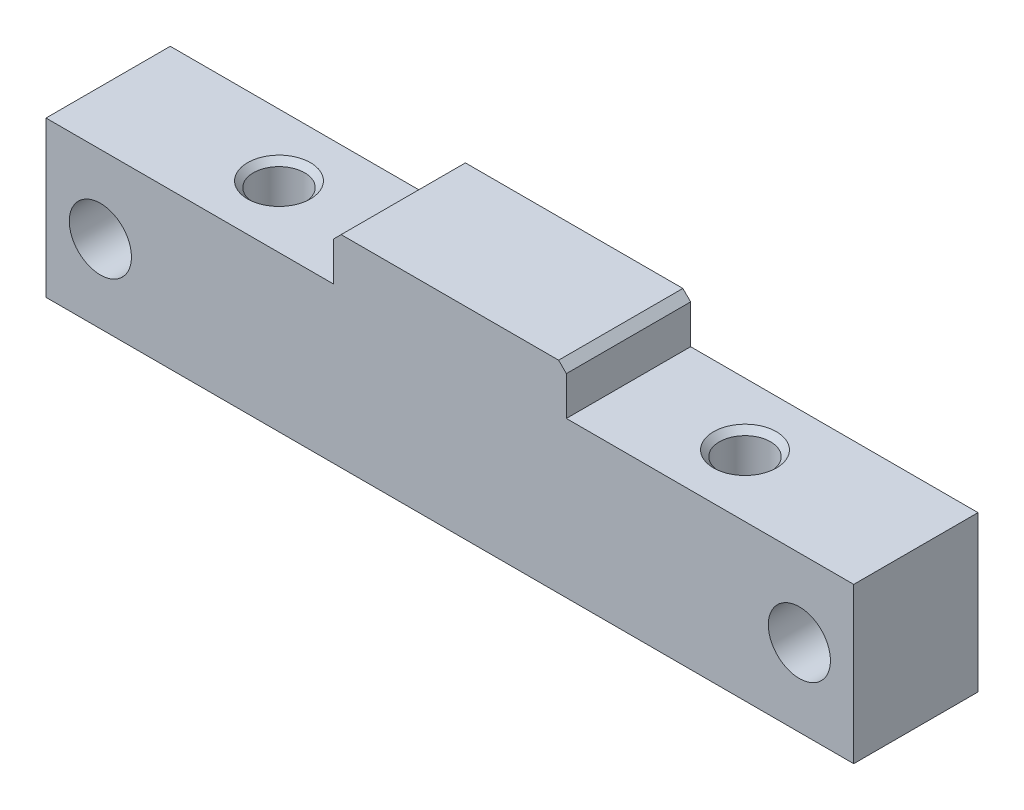
from build123d import *

# Parameters (mm, degrees)
EXTRUDE_1_DEPTH              = 8
SKETCH_4_R                   = 2
CUT_EXTRUDE_3_DEPTH          = 31.149626863
HOLE_WIZARD_M4_1_D           = 3.3
HOLE_WIZARD_M4_1_DEPTH       = 10
HOLE_WIZARD_M4_1_CSINK_D     = 4.05
HOLE_WIZARD_M4_1_CSINK_ANGLE = 90
HOLE_WIZARD_M4_1_TIP         = 0.991420021
CHAMFER_1_SIZE               = 0.5


with BuildPart() as part:
    # 草图2 → 凸台-拉伸1 (new body)
    with BuildSketch(Plane.XY):
        Polygon((-7.5, 13), (7.5, 13), (7.5, 10), (26, 10), (26, 0), (-26, 0), (-26, 10), (-7.5, 10), align=None)
    extrude(amount=EXTRUDE_1_DEPTH)

    # 草图4 → 切除-拉伸3 (cut, through all)
    with BuildSketch(Plane.XY.offset(8)):
        with Locations((-22.5, 5)):
            Circle(SKETCH_4_R)
        with Locations(Location((22.5, 5, 0), (0, 0, 180))):
            Circle(SKETCH_4_R)
    extrude(amount=-CUT_EXTRUDE_3_DEPTH, mode=Mode.SUBTRACT)

    # M4 螺纹孔1
    with Locations(Plane(origin=(-15, 10, 4), x_dir=(1, 0, 0), z_dir=(0, 1, 0))):
        with Locations((0, 0), (30, 0)):
            CounterSinkHole(HOLE_WIZARD_M4_1_D / 2, HOLE_WIZARD_M4_1_CSINK_D / 2, depth=HOLE_WIZARD_M4_1_DEPTH, counter_sink_angle=HOLE_WIZARD_M4_1_CSINK_ANGLE)
            with Locations((0, 0, -(HOLE_WIZARD_M4_1_DEPTH + HOLE_WIZARD_M4_1_TIP / 2))):  # 118° drill point
                Cone(0, HOLE_WIZARD_M4_1_D / 2, HOLE_WIZARD_M4_1_TIP, mode=Mode.SUBTRACT)

    # 倒角1
    chamfer_1_edges = [part.edges().sort_by_distance(p)[0] for p in [
        (-7.5, 13, 4),
        (7.5, 13, 4),
    ]]
    chamfer(chamfer_1_edges, length=CHAMFER_1_SIZE)


solid = part.part
